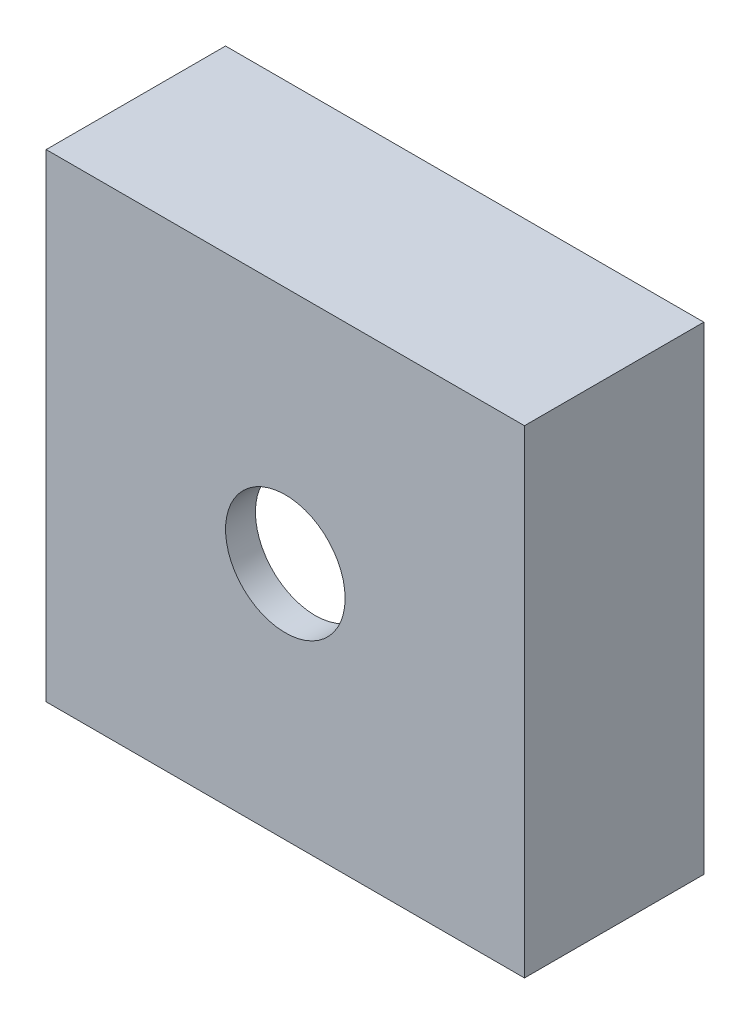
from build123d import *

# Parameters (mm, degrees)
SKETCH1_W           = 80
SKETCH1_H           = 80
BOSS_EXTRUDE1_DEPTH = 30
SHELL1_T            = -5
SKETCH3_R           = 10
CUT_EXTRUDE1_DEPTH  = 10


with BuildPart() as part:
    # Sketch1 → Boss-Extrude1 (new body)
    with BuildSketch(Plane.XY):
        Rectangle(SKETCH1_W, SKETCH1_H)
    extrude(amount=BOSS_EXTRUDE1_DEPTH)

    # Shell1
    shell1_openings = [part.faces().sort_by_distance(p)[0] for p in [
        (0, 0, 0),
    ]]
    offset(amount=SHELL1_T, openings=shell1_openings, kind=Kind.INTERSECTION)

    # Sketch3 → Cut-Extrude1 (cut)
    with BuildSketch(Plane.XY.offset(30)):
        Circle(SKETCH3_R)
    extrude(amount=-CUT_EXTRUDE1_DEPTH, mode=Mode.SUBTRACT)


solid = part.part
